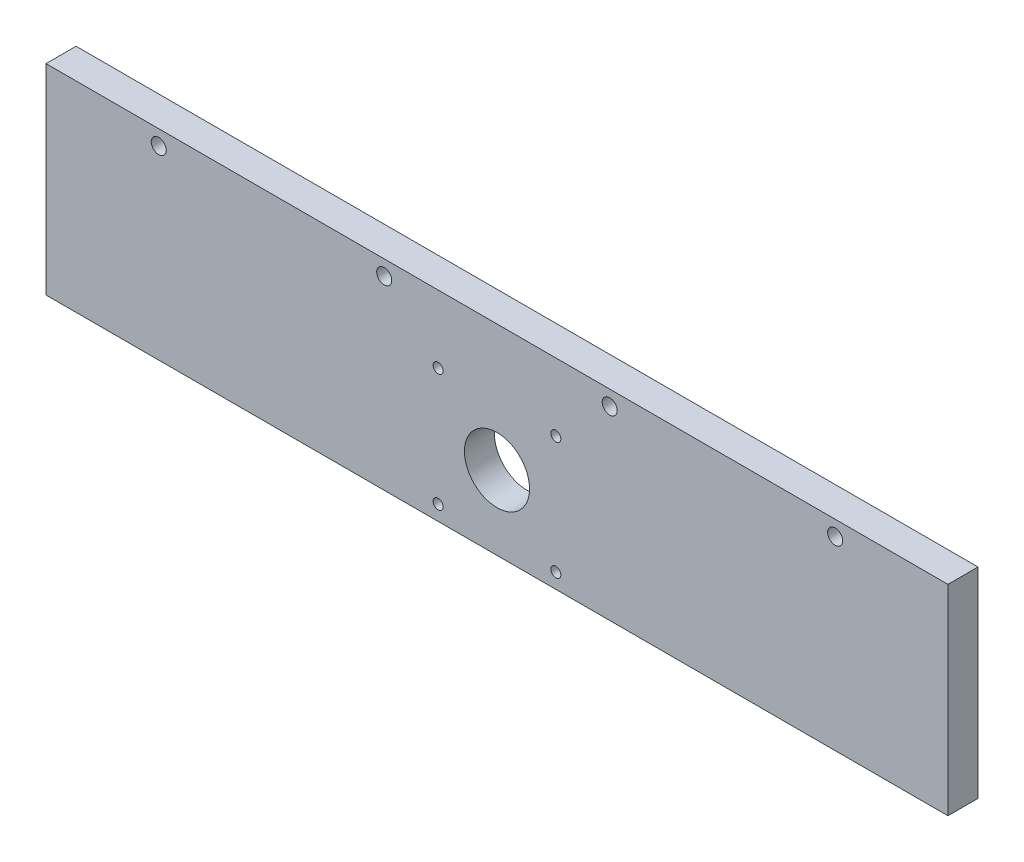
from build123d import *

# Parameters (mm, degrees)
SKETCH1_W           = 360
SKETCH1_H           = 80
BOSS_EXTRUDE1_DEPTH = 12
CUT_EXTRUDE1_REACH  = 186.781
SKETCH2_R           = 3
LPATTERN1_COUNT     = 4
LPATTERN1_PITCH     = 90
CUT_EXTRUDE2_REACH  = 186.781
SKETCH3_R           = 13
CUT_EXTRUDE3_REACH  = 186.781
SKETCH4_R           = 2


with BuildPart() as part:
    # Sketch1 → Boss-Extrude1 (new body)
    with BuildSketch(Plane.XY):
        Rectangle(SKETCH1_W, SKETCH1_H)
    extrude(amount=BOSS_EXTRUDE1_DEPTH)

    # Sketch2 → Cut-Extrude1 (cut, up to next)
    with BuildSketch(Plane.XY.offset(12), mode=Mode.PRIVATE) as cut_extrude1_sk1:
        with Locations((135, 34)):
            Circle(SKETCH2_R)
    cut_extrude1_tool1 = extrude(cut_extrude1_sk1.sketch, amount=-CUT_EXTRUDE1_REACH, mode=Mode.PRIVATE) & part.part
    cut_extrude1 = cut_extrude1_tool1.solids().sort_by_distance((135, 34, 12))[0]
    add(cut_extrude1, mode=Mode.SUBTRACT)

    # LPattern1: Cut-Extrude1 ×4
    with Locations(*[(-i * LPATTERN1_PITCH, 0, 0) for i in range(1, LPATTERN1_COUNT)]):
        add(cut_extrude1, mode=Mode.SUBTRACT)

    # Sketch3 → Cut-Extrude2 (cut, up to next)
    with BuildSketch(Plane.XY.offset(12), mode=Mode.PRIVATE) as cut_extrude2_sk1:
        with Locations((0, -10.5)):
            Circle(SKETCH3_R)
    cut_extrude2_tool1 = extrude(cut_extrude2_sk1.sketch, amount=-CUT_EXTRUDE2_REACH, mode=Mode.PRIVATE) & part.part
    add(cut_extrude2_tool1.solids().sort_by_distance((0, -10.5, 12))[0], mode=Mode.SUBTRACT)

    # Sketch4 → Cut-Extrude3 (cut, up to next)
    with BuildSketch(Plane.XY.offset(12), mode=Mode.PRIVATE) as cut_extrude3_sk1:
        with Locations((-23.5, 13)):
            Circle(SKETCH4_R)
    cut_extrude3_tool1 = extrude(cut_extrude3_sk1.sketch, amount=-CUT_EXTRUDE3_REACH, mode=Mode.PRIVATE) & part.part
    # Sketch4 → Cut-Extrude3 (cut, up to next)
    with BuildSketch(Plane.XY.offset(12), mode=Mode.PRIVATE) as cut_extrude3_sk2:
        with Locations((-23.5, -34)):
            Circle(SKETCH4_R)
    cut_extrude3_tool2 = extrude(cut_extrude3_sk2.sketch, amount=-CUT_EXTRUDE3_REACH, mode=Mode.PRIVATE) & part.part
    cut_extrude3_1 = cut_extrude3_tool1.solids().sort_by_distance((-23.5, 13, 12))[0]
    add(cut_extrude3_1, mode=Mode.SUBTRACT)
    cut_extrude3_2 = cut_extrude3_tool2.solids().sort_by_distance((-23.5, -34, 12))[0]
    add(cut_extrude3_2, mode=Mode.SUBTRACT)
    cut_extrude3 = cut_extrude3_1 + cut_extrude3_2  # Cut-Extrude3 as one shape, for the pattern or mirror that repeats it

    # Mirror2: Cut-Extrude3 across plane
    add(cut_extrude3.mirror(Plane(origin=(0, 0, 0), x_dir=(0, 0, 1), z_dir=(1, 0, 0))), mode=Mode.SUBTRACT)


solid = part.part
